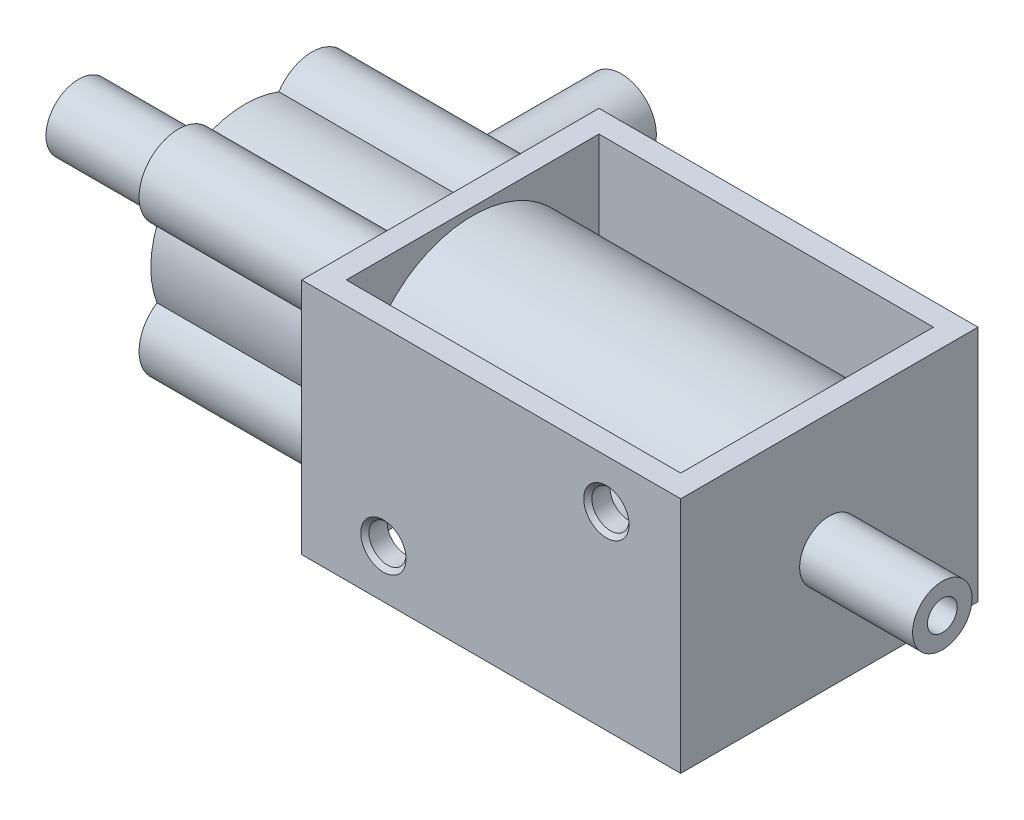
from build123d import *

# Parameters (mm, degrees)
SKETCH_1_W          = 25.5
SKETCH_1_H          = 20
SKETCH_1_W_2        = 22.5
SKETCH_1_H_2        = 17
EXTRUDE_1_DEPTH     = 16
M3X0_5_1_AT_2_COUNT = 2
M3X0_5_1_AT_2_PITCH = 17.755280905
EXTRUDE_2_REACH     = 32.529
SKETCH_4_R          = 7.5
EXTRUDE_3_DEPTH     = 13.8
SKETCH_6_R          = 2
EXTRUDE_4_DEPTH     = 7.6
SKETCH_7_R          = 2.2
EXTRUDE_5_DEPTH     = 11.2
SKETCH_9_R          = 2.363999551
EXTRUDE_6_DEPTH     = 18.4
SKETCH_10_R         = 1
CUT_EXTRUDE_1_DEPTH = 64.009285059
SKETCH_11_R         = 1
CUT_EXTRUDE_2_DEPTH = 18.4


with BuildPart() as part:
    # 草图1 → 凸台-拉伸1 (new body)
    with BuildSketch(Plane(origin=(0, 0, 0), x_dir=(1, 0, 0), z_dir=(0, 1, 0))):
        Rectangle(SKETCH_1_W, SKETCH_1_H)
        Rectangle(SKETCH_1_W_2, SKETCH_1_H_2, mode=Mode.SUBTRACT)
    extrude(amount=EXTRUDE_1_DEPTH)

    # 草图3 → M3x0.5 螺纹孔1 (revolve, cut)
    with BuildSketch(Plane(origin=(7.75, 12.75, 10), x_dir=(0, -1, 0), z_dir=(1, 0, 0))):
        Polygon((0, 0), (0, 1.5), (1.25, 1.5), (1.25, 0.275), (1.525, 0), align=None)
    m3x0_5_1 = revolve(axis=Axis((7.75, 12.75, 16.35), (0, 0, -1)), mode=Mode.SUBTRACT)

    # M3x0.5 螺纹孔1 at 2: M3x0.5 螺纹孔1 ×2
    with Locations(*[Vector(-0.8448190755542286, -0.5350520811843448, 0) * (i * M3X0_5_1_AT_2_PITCH) for i in range(1, M3X0_5_1_AT_2_COUNT)]):
        add(m3x0_5_1, mode=Mode.SUBTRACT)

    # 草图4 → 凸台-拉伸2 (add, up to next)
    with BuildSketch(Plane(origin=(-11.25, 0, 0), x_dir=(0, 0, -1), z_dir=(1, 0, 0)), mode=Mode.PRIVATE) as extrude_2_sk1:
        with Locations(Location((0, 8, 0), (0, 0, 180))):
            Circle(SKETCH_4_R)
    extrude_2_tool1 = extrude(extrude_2_sk1.sketch, amount=EXTRUDE_2_REACH, mode=Mode.PRIVATE) - part.part
    add(extrude_2_tool1.solids().sort_by_distance((-11.25, 8, 0))[0])

    # 草图5 → 凸台-拉伸3 (add)
    with BuildSketch(Plane.ZY.offset(12.75)):
        with BuildLine():
            ThreePointArc((-5.931717466, 10.266545369), (-6.35, 8), (-5.931717466, 5.733454631))
            ThreePointArc((-5.931717466, 5.733454631), (-6.363961031, 1.636038969), (-2.266545369, 2.068282534))
            ThreePointArc((-2.266545369, 2.068282534), (0, 1.65), (2.266545369, 2.068282534))
            ThreePointArc((2.266545369, 2.068282534), (6.363961031, 1.636038969), (5.931717466, 5.733454631))
            ThreePointArc((5.931717466, 5.733454631), (6.35, 8), (5.931717466, 10.266545369))
            ThreePointArc((5.931717466, 10.266545369), (6.363961031, 14.363961031), (2.266545369, 13.931717466))
            ThreePointArc((2.266545369, 13.931717466), (0, 14.35), (-2.266545369, 13.931717466))
            ThreePointArc((-2.266545369, 13.931717466), (-6.363961031, 14.363961031), (-5.931717466, 10.266545369))
        make_face()
    extrude(amount=EXTRUDE_3_DEPTH)

    # 草图6 → 凸台-拉伸4 (add)
    with BuildSketch(Plane(origin=(12.75, 0, 0), x_dir=(0, 0, -1), z_dir=(1, 0, 0))):
        with Locations(Location((0, 8, 0), (0, 0, 180))):
            Circle(SKETCH_6_R)
    extrude(amount=EXTRUDE_4_DEPTH)

    # 草图7 → 凸台-拉伸5 (add)
    with BuildSketch(Plane.ZY.offset(26.55)):
        with Locations((0, 8)):
            Circle(SKETCH_7_R)
    extrude(amount=EXTRUDE_5_DEPTH)

    # 草图9 → 凸台-拉伸6 (add)
    with BuildSketch(Plane.XY):
        with Locations((-19.65, 8)):
            Circle(SKETCH_9_R)
    extrude(amount=-EXTRUDE_6_DEPTH)

    # 草图10 → 切除-拉伸1 (cut, through all)
    with BuildSketch(Plane.ZY.offset(37.75)):
        with Locations((0, 8)):
            Circle(SKETCH_10_R)
    extrude(amount=-CUT_EXTRUDE_1_DEPTH, mode=Mode.SUBTRACT)

    # 草图11 → 切除-拉伸2 (cut)
    with BuildSketch(Plane(origin=(0, 0, -18.4), x_dir=(-1, 0, 0), z_dir=(0, 0, -1))):
        with Locations((19.65, 8)):
            Circle(SKETCH_11_R)
    extrude(amount=-CUT_EXTRUDE_2_DEPTH, mode=Mode.SUBTRACT)


solid = part.part
